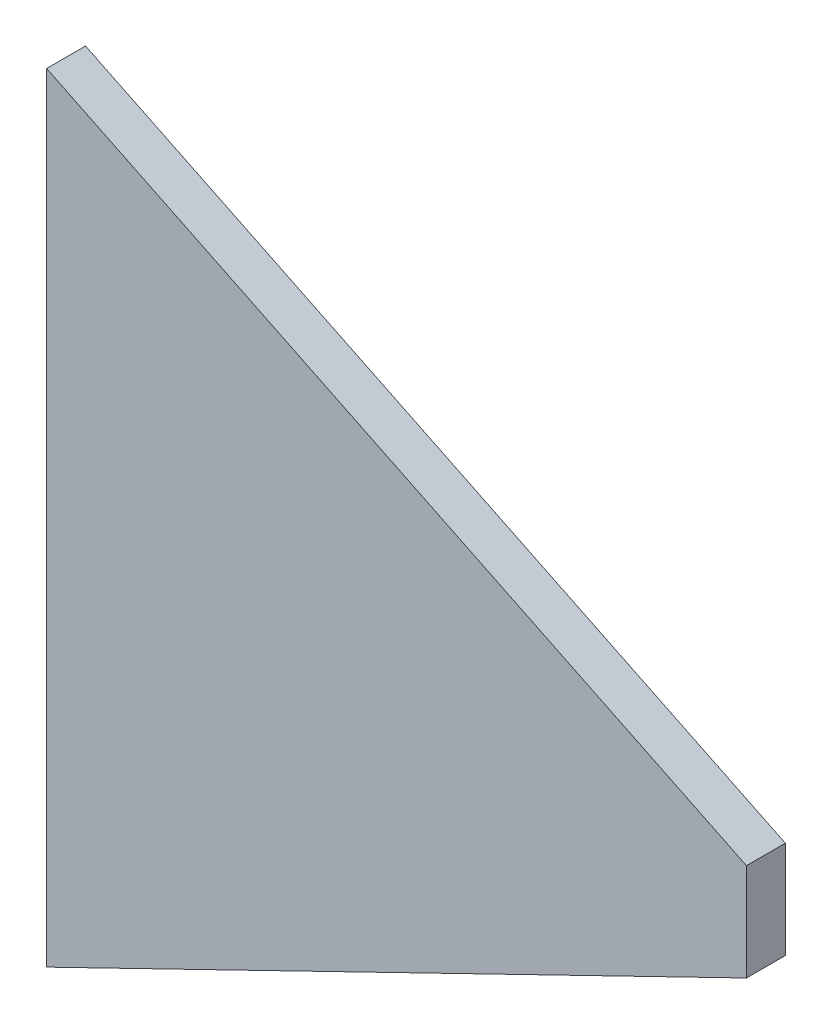
from build123d import *

# Parameters (mm, degrees)
BOSS_EXTRUDE1_DEPTH = 1.27


with BuildPart() as part:
    # Sketch1 → Boss-Extrude1 (new body)
    with BuildSketch(Plane.XY):
        Polygon((0, 0), (0, 3.175), (-22.84014763, 14.2875), (-22.84014763, -11.1125), align=None)
    extrude(amount=BOSS_EXTRUDE1_DEPTH)


solid = part.part
